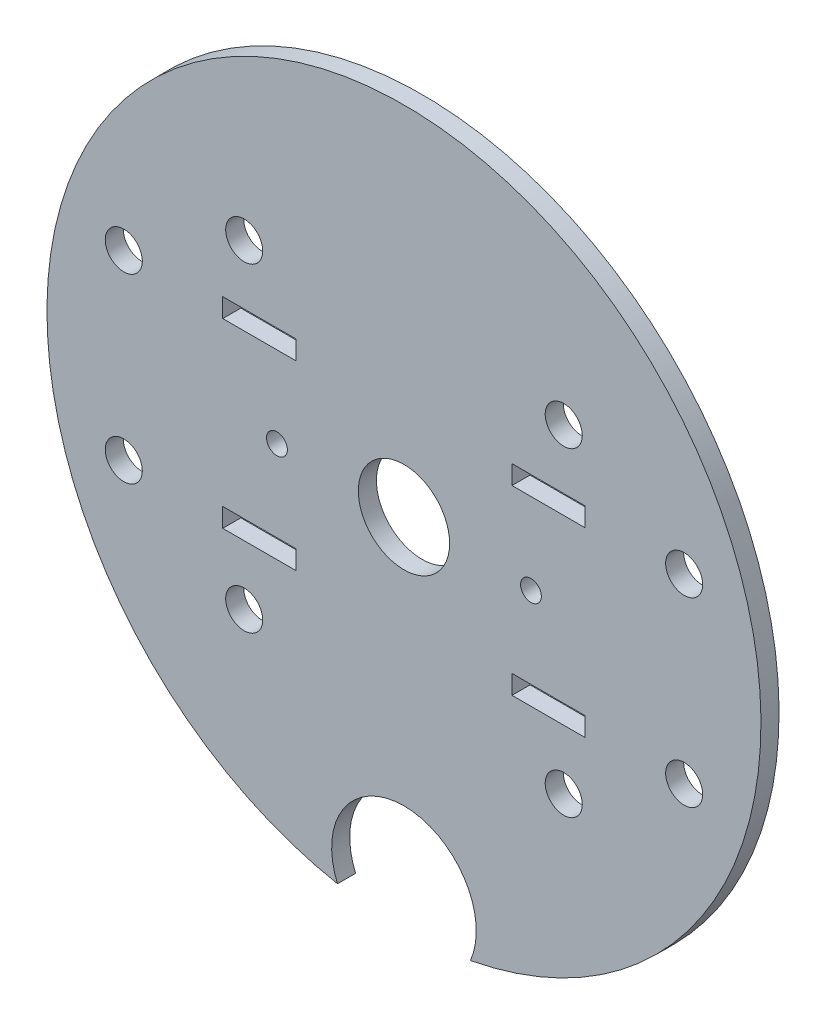
from build123d import *

# Parameters (mm, degrees)
SKETCH_1_R      = 5.05
SKETCH_1_R_2    = 2.05
SKETCH_1_R_3    = 1.15
SKETCH_1_W      = 8.1
SKETCH_1_H      = 2.1
EXTRUDE_1_DEPTH = 2


with BuildPart() as part:
    # 草图1 → 凸台-拉伸1 (new body)
    with BuildSketch(Plane.XY):
        with BuildLine():
            ThreePointArc((-7.35497191, -38.809204942), (0, 39.5), (7.35497191, -38.809204942))
            ThreePointArc((7.35497191, -38.809204942), (0, -27.662081143), (-7.35497191, -38.809204942))
        make_face()
        Circle(SKETCH_1_R, mode=Mode.SUBTRACT)
        with Locations((-17.67766953, -17.67766953)):
            Circle(SKETCH_1_R_2, mode=Mode.SUBTRACT)
        with Locations((-17.67766953, 17.67766953)):
            Circle(SKETCH_1_R_2, mode=Mode.SUBTRACT)
        with Locations((17.67766953, 17.67766953)):
            Circle(SKETCH_1_R_2, mode=Mode.SUBTRACT)
        with Locations((17.67766953, -17.67766953)):
            Circle(SKETCH_1_R_2, mode=Mode.SUBTRACT)
        with Locations((31, 10.05)):
            Circle(SKETCH_1_R_2, mode=Mode.SUBTRACT)
        with Locations(Location((31, -10.05, 0), (0, 0, 180))):
            Circle(SKETCH_1_R_2, mode=Mode.SUBTRACT)
        with Locations((-31, -10.05)):
            Circle(SKETCH_1_R_2, mode=Mode.SUBTRACT)
        with Locations(Location((-31, 10.05, 0), (0, 0, 180))):
            Circle(SKETCH_1_R_2, mode=Mode.SUBTRACT)
        with Locations((-14.05, 0)):
            Circle(SKETCH_1_R_3, mode=Mode.SUBTRACT)
        with Locations((14.05, 0)):
            Circle(SKETCH_1_R_3, mode=Mode.SUBTRACT)
        with Locations((16, -10.05)):
            Rectangle(SKETCH_1_W, SKETCH_1_H, mode=Mode.SUBTRACT)
        with Locations((16, 10.05)):
            Rectangle(SKETCH_1_W, SKETCH_1_H, mode=Mode.SUBTRACT)
        with Locations((-16, 10.05)):
            Rectangle(SKETCH_1_W, SKETCH_1_H, mode=Mode.SUBTRACT)
        with Locations((-16, -10.05)):
            Rectangle(SKETCH_1_W, SKETCH_1_H, mode=Mode.SUBTRACT)
    extrude(amount=EXTRUDE_1_DEPTH)


solid = part.part
